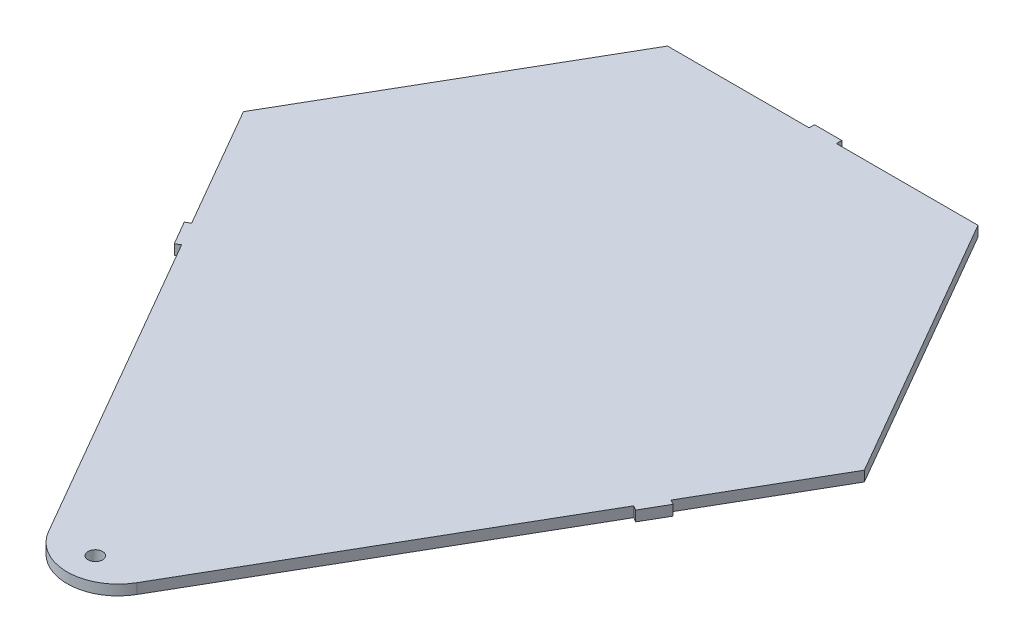
from build123d import *

# Parameters (mm, degrees)
BOSS_EXTRUDE1_DEPTH = 5.63
FILLET1_R           = 28
SKETCH2_R           = 4
CUT_EXTRUDE4_DEPTH  = 10


with BuildPart() as part:
    # Sketch1 → Boss-Extrude1 (new body)
    with BuildSketch(Plane(origin=(0, 0, 0), x_dir=(1, 0, 0), z_dir=(0, 1, 0))):
        Polygon((-7.5, 147.657331345), (-85.25, 147.657331345), (-170.5, 0), (-131.650528172, -67.289259053), (-134.205303113, -68.764259053), (-126.705303113, -81.75464011), (-124.150528172, -80.27964011), (-85.25, -147.657331345), (0, -295.31466269), (85.25, -147.657331345), (124.150528172, -80.27964011), (126.705303113, -81.75464011), (134.205303113, -68.764259053), (131.650528172, -67.289259053), (170.5, 0), (85.25, 147.657331345), (7.5, 147.657331345), (7.5, 150.607331345), (-7.5, 150.607331345), align=None)
    extrude(amount=BOSS_EXTRUDE1_DEPTH)

    # Fillet1
    fillet1_edges = [part.edges().sort_by_distance(p)[0] for p in [
        (0, 2.815, 295.31466269),
    ]]
    fillet(fillet1_edges, radius=FILLET1_R)

    # Sketch2 → Cut-Extrude4 (cut)
    with BuildSketch(Plane(origin=(0, 5.63, 0), x_dir=(1, 0, 0), z_dir=(0, 1, 0))):
        with Locations(Location((0, -251.834791554, 0), (0, 0, 270))):
            Circle(SKETCH2_R)
    extrude(amount=-CUT_EXTRUDE4_DEPTH, mode=Mode.SUBTRACT)


solid = part.part
